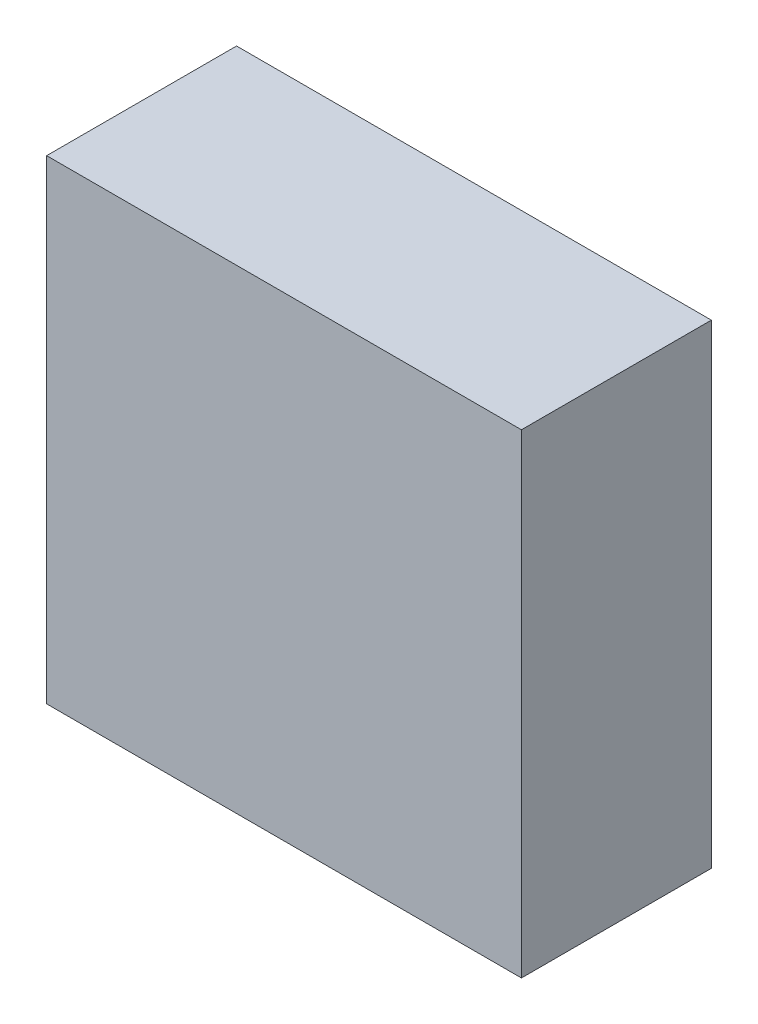
from build123d import *

# Parameters (mm, degrees)
SKETCH1_W           = 50
SKETCH1_H           = 50
BOSS_EXTRUDE1_DEPTH = 20


with BuildPart() as part:
    # Sketch1 → Boss-Extrude1 (new body)
    with BuildSketch(Plane.XY):
        with Locations((25, 25)):
            Rectangle(SKETCH1_W, SKETCH1_H)
    extrude(amount=BOSS_EXTRUDE1_DEPTH)


solid = part.part
